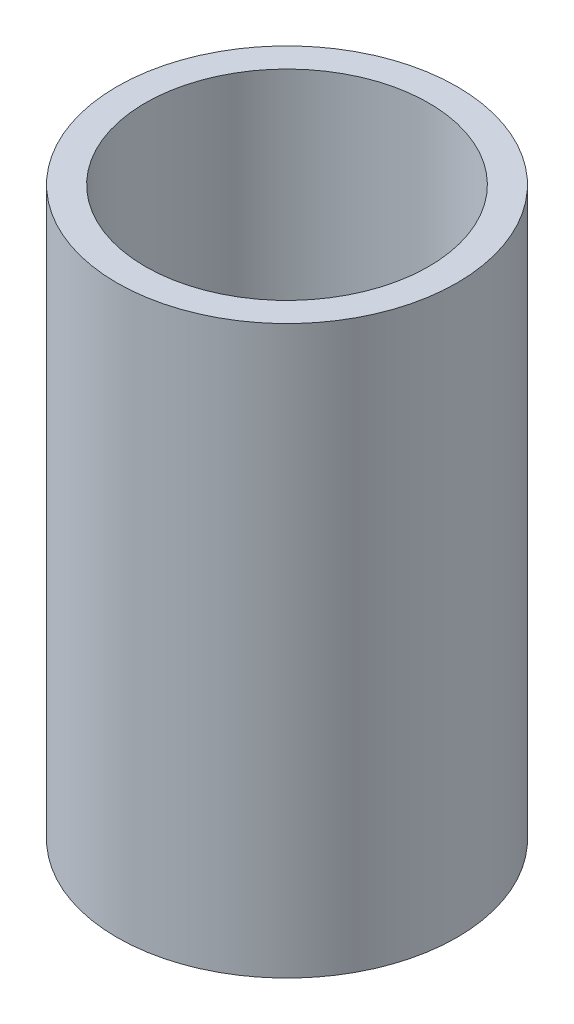
from build123d import *

# Parameters (mm, degrees)
SKETCH1_R           = 15
SKETCH1_R_2         = 12.5
BOSS_EXTRUDE1_DEPTH = 50


with BuildPart() as part:
    # Sketch1 → Boss-Extrude1 (new body)
    with BuildSketch(Plane(origin=(0, 0, 0), x_dir=(1, 0, 0), z_dir=(0, 1, 0))):
        with Locations(Location((0, 0, 0), (0, 0, 270))):
            Circle(SKETCH1_R)
        with Locations(Location((0, 0, 0), (0, 0, 270))):
            Circle(SKETCH1_R_2, mode=Mode.SUBTRACT)
    extrude(amount=BOSS_EXTRUDE1_DEPTH)


solid = part.part
